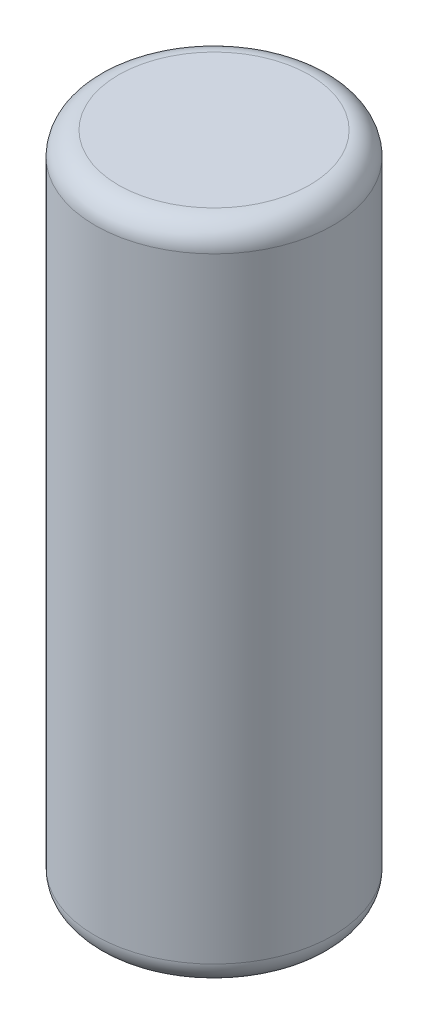
from build123d import *

# Parameters (mm, degrees)
SKETCH2_R           = 51
BOSS_EXTRUDE1_DEPTH = 284
FILLET1_R           = 10


with BuildPart() as part:
    # Sketch2 → Boss-Extrude1 (new body)
    with BuildSketch(Plane(origin=(0, 0, 0), x_dir=(1, 0, 0), z_dir=(0, 1, 0))):
        with Locations(Location((0, 0, 0), (0, 0, 270))):
            Circle(SKETCH2_R)
    extrude(amount=BOSS_EXTRUDE1_DEPTH)

    # Fillet1
    fillet1_edges = [part.edges().sort_by_distance(p)[0] for p in [
        (0, 0, -51),
        (0, 284, -51),
    ]]
    fillet(fillet1_edges, radius=FILLET1_R)


solid = part.part
